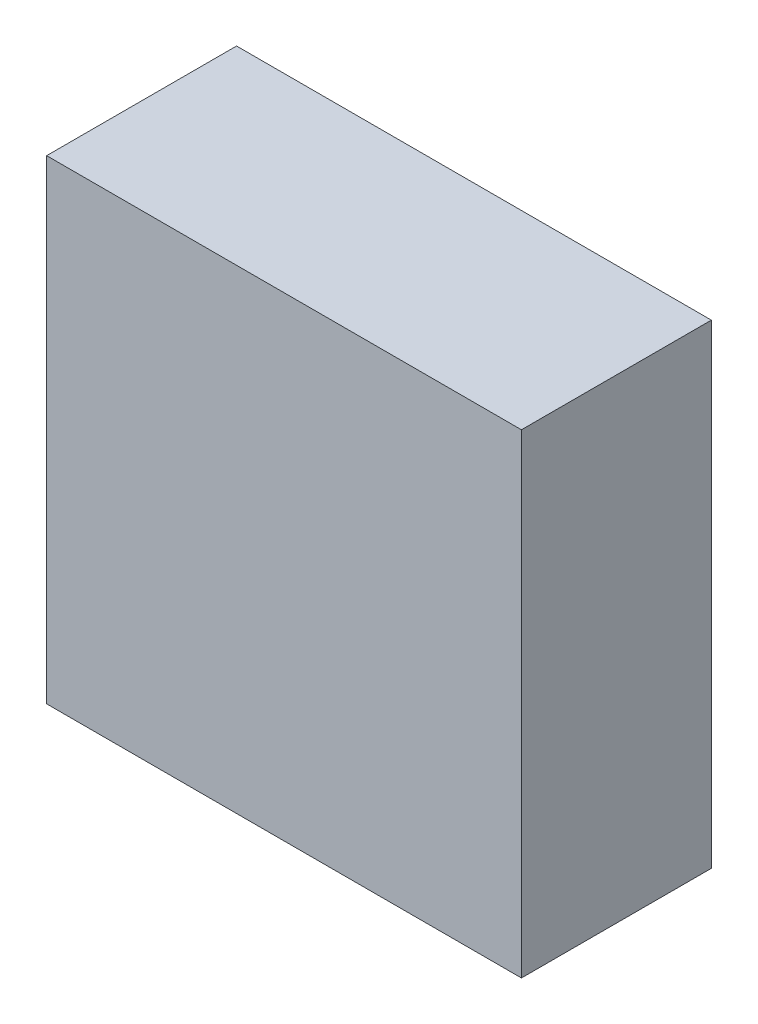
from build123d import *

# Parameters (mm, degrees)
SKETCH_2_W      = 1000
SKETCH_2_H      = 1000
EXTRUDE_1_DEPTH = 400


with BuildPart() as part:
    # ｽｹｯﾁ2 → ﾎﾞｽ - 押し出し1 (new body)
    with BuildSketch(Plane.XY):
        with Locations((500, 500)):
            Rectangle(SKETCH_2_W, SKETCH_2_H)
    extrude(amount=EXTRUDE_1_DEPTH)


solid = part.part
